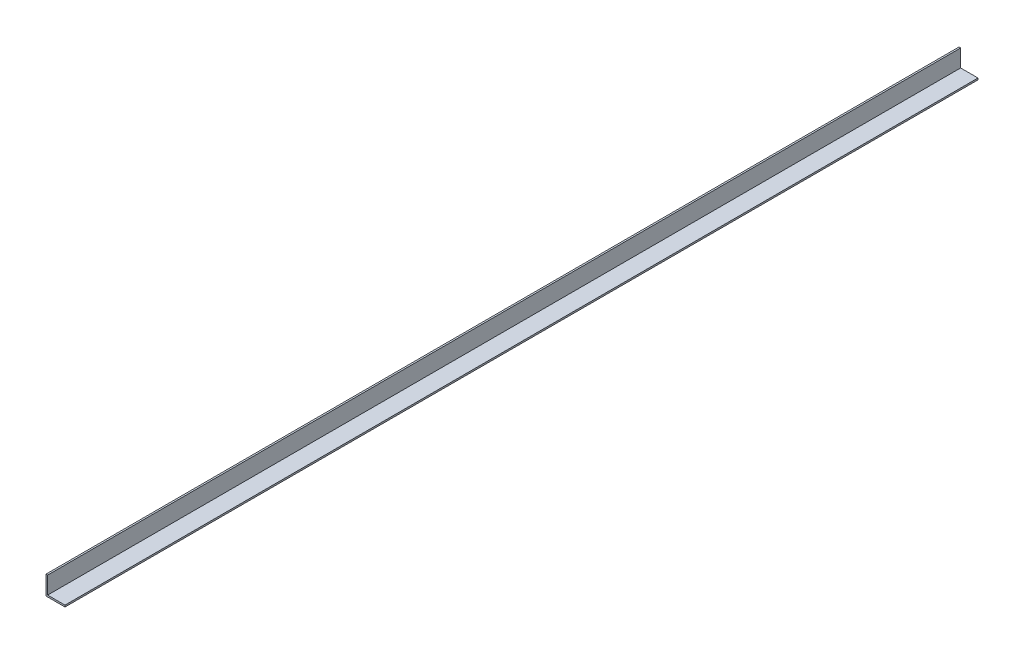
from build123d import *

# Parameters (mm, degrees)
SALIENTE_EXTRUIR1_DEPTH = 6100


with BuildPart() as part:
    # Croquis1 → Saliente-Extruir1 (new body)
    with BuildSketch(Plane.XY):
        Polygon((0, 127), (0, 0), (127, 0), (127, 11.1), (11.1, 11.1), (11.1, 127), align=None)
    extrude(amount=-SALIENTE_EXTRUIR1_DEPTH)


solid = part.part
